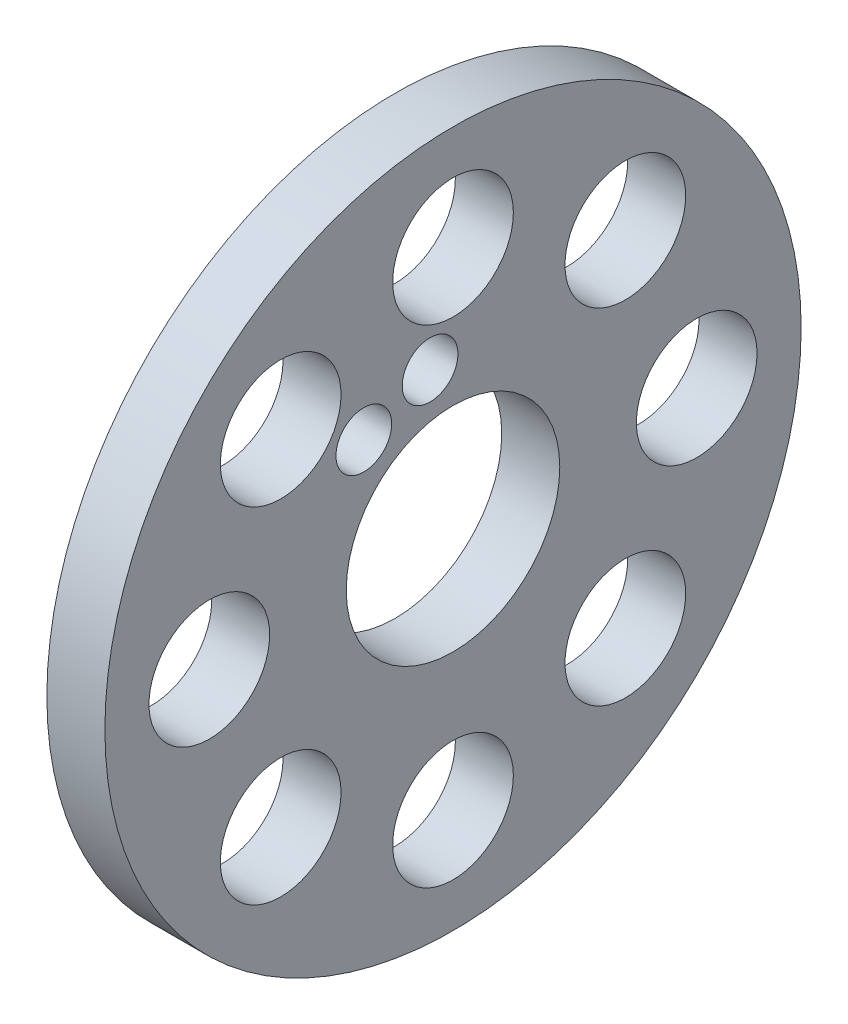
from build123d import *

# Parameters (mm, degrees)
AXIAL_PROFILE_MM_W     = 5
AXIAL_PROFILE_MM_H     = 20.8
AXIAL_HOLES_DEPTH      = 155.634051877
AXIAL_HOLES_DEPTH_BACK = 155.634051877
SKETCH2_R              = 5.2
SKETCH2_R_2            = 2.4


with BuildPart() as part:
    # Axial profile (mm) → Full revolution (revolve)
    with BuildSketch(Plane.XY, mode=Mode.PRIVATE) as full_revolution_sk:
        with Locations((146.2, 19.6)):
            Rectangle(AXIAL_PROFILE_MM_W, AXIAL_PROFILE_MM_H)
    revolve(full_revolution_sk.sketch.rotate(Axis((-110, 0, 0), (1, 0, 0)), 90), axis=Axis((-110, 0, 0), (1, 0, 0)))

    # Sketch2 → Axial holes (cut, two sides: drawn at the far end of the back side and taken through both)
    with BuildSketch(Plane(origin=(0, 0, 0), x_dir=(0, 0, -1), z_dir=(1, 0, 0)).offset(-AXIAL_HOLES_DEPTH_BACK)):
        with Locations((0, 21)):
            Circle(SKETCH2_R)
        with Locations((-14.849242405, 14.849242405)):
            Circle(SKETCH2_R)
        with Locations((-21, 0)):
            Circle(SKETCH2_R)
        with Locations((-14.849242405, -14.849242405)):
            Circle(SKETCH2_R)
        with Locations((0, -21)):
            Circle(SKETCH2_R)
        with Locations((14.849242405, -14.849242405)):
            Circle(SKETCH2_R)
        with Locations((21, 0)):
            Circle(SKETCH2_R)
        with Locations((14.849242405, 14.849242405)):
            Circle(SKETCH2_R)
        with Locations((-1.977382665, 12.848733704)):
            Circle(SKETCH2_R_2)
        with Locations((-7.687206041, 10.483647423)):
            Circle(SKETCH2_R_2)
    extrude(amount=AXIAL_HOLES_DEPTH + AXIAL_HOLES_DEPTH_BACK, mode=Mode.SUBTRACT)


solid = part.part
